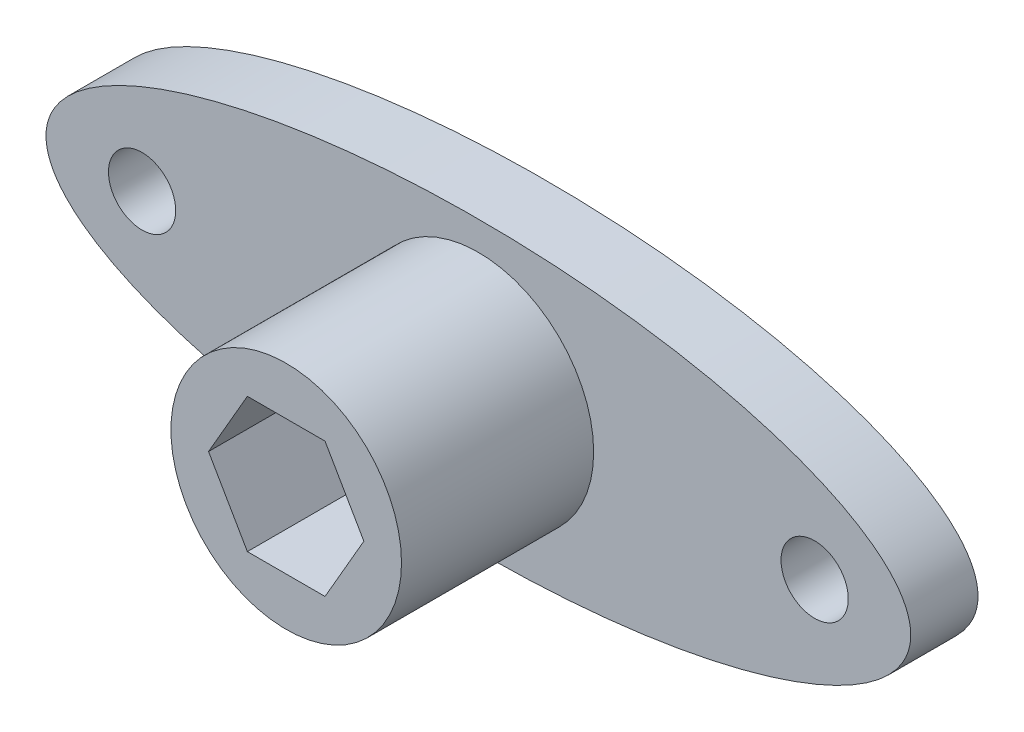
from build123d import *

# Parameters (mm, degrees)
SKETCH2_RX          = 22.5
SKETCH2_RY          = 7.5
SKETCH2_R           = 1.75
BOSS_EXTRUDE1_DEPTH = 3.5
SKETCH3_R           = 6
BOSS_EXTRUDE3_DEPTH = 10
CUT_EXTRUDE1_DEPTH  = 6.5


with BuildPart() as part:
    # Sketch2 → Boss-Extrude1 (new body)
    with BuildSketch(Plane.XY):
        with Locations((0, 0)):
            Ellipse(SKETCH2_RX, SKETCH2_RY)
        with Locations((-17.5, 0)):
            Circle(SKETCH2_R, mode=Mode.SUBTRACT)
        with Locations(Location((17.5, 0, 0), (0, 0, 180))):
            Circle(SKETCH2_R, mode=Mode.SUBTRACT)
    extrude(amount=BOSS_EXTRUDE1_DEPTH)

    # Sketch3 → Boss-Extrude3 (add)
    with BuildSketch(Plane.XY.offset(3.5)):
        Circle(SKETCH3_R)
    extrude(amount=BOSS_EXTRUDE3_DEPTH)

    # Sketch4 → Cut-Extrude1 (cut)
    with BuildSketch(Plane.XY.offset(13.5)):
        Polygon((2.020725942, -3.5), (4.041451884, 0), (2.020725942, 3.5), (-2.020725942, 3.5), (-4.041451884, 0), (-2.020725942, -3.5), align=None)
    extrude(amount=-CUT_EXTRUDE1_DEPTH, mode=Mode.SUBTRACT)


solid = part.part
